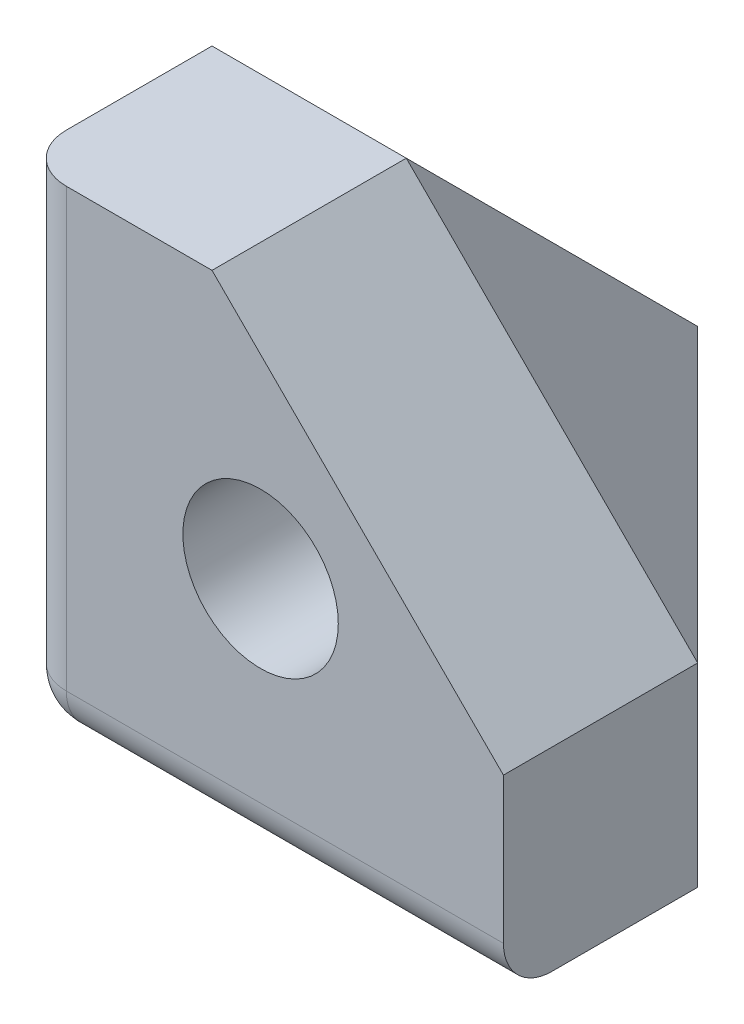
from build123d import *

# Parameters (mm, degrees)
SKETCH1_W           = 10
SKETCH1_H           = 10
BOSS_EXTRUDE1_DEPTH = 10
SKETCH2_R           = 1.6
CUT_EXTRUDE1_DEPTH  = 3.2
SKETCH3_R           = 1.6
CUT_EXTRUDE3_DEPTH  = 3.2
SKETCH4_R           = 1.6
CUT_EXTRUDE4_DEPTH  = 3.2
FILLET2_R           = 1
CHAMFER1_SIZE       = 6


with BuildPart() as part:
    # Sketch1 → Boss-Extrude1 (new body)
    with BuildSketch(Plane(origin=(0, 0, 0), x_dir=(1, 0, 0), z_dir=(0, 1, 0))):
        Rectangle(SKETCH1_W, SKETCH1_H)
    extrude(amount=BOSS_EXTRUDE1_DEPTH)

    # Sketch2 → Cut-Extrude1 (cut)
    with BuildSketch(Plane.XY.offset(5)):
        with Locations((0, 5)):
            Circle(SKETCH2_R)
    extrude(amount=-CUT_EXTRUDE1_DEPTH, mode=Mode.SUBTRACT)

    # Sketch3 → Cut-Extrude3 (cut)
    with BuildSketch(Plane(origin=(0, 0, 0), x_dir=(-1, 0, 0), z_dir=(0, -1, 0))):
        with Locations(Location((0, 0, 0), (0, 0, 90))):
            Circle(SKETCH3_R)
    extrude(amount=-CUT_EXTRUDE3_DEPTH, mode=Mode.SUBTRACT)

    # Sketch4 → Cut-Extrude4 (cut)
    with BuildSketch(Plane(origin=(-5, 0, 0), x_dir=(0, 0, -1), z_dir=(1, 0, 0))):
        with Locations((0, 5)):
            Circle(SKETCH4_R)
    extrude(amount=CUT_EXTRUDE4_DEPTH, mode=Mode.SUBTRACT)

    # Fillet2
    fillet2_edges = [part.edges().sort_by_distance(p)[0] for p in [
        (0, 0, 5),
        (-5, 0, 0),
        (-5, 5, 5),
    ]]
    fillet(fillet2_edges, radius=FILLET2_R)

    # Chamfer1
    chamfer1_edges = [part.edges().sort_by_distance(p)[0] for p in [
        (5, 10, 0),
        (5, 5, -5),
        (0, 10, -5),
    ]]
    chamfer(chamfer1_edges, length=CHAMFER1_SIZE)


solid = part.part
